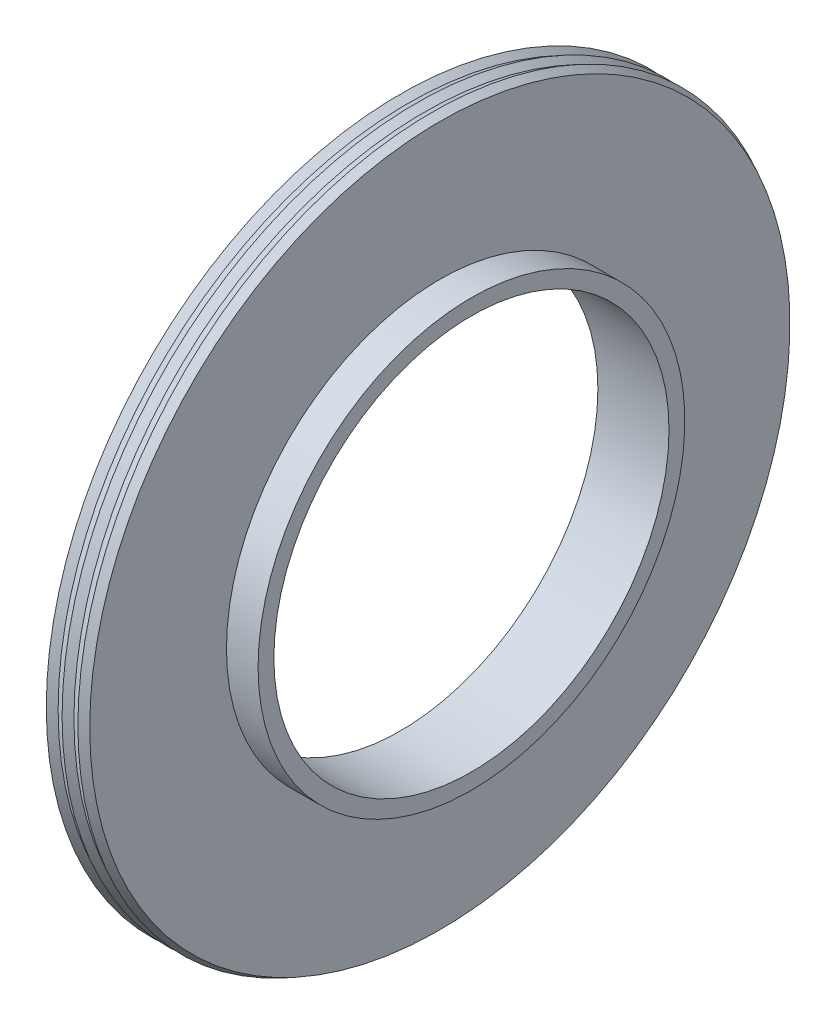
from build123d import *


with BuildPart() as part:
    # 草图1 → 旋转1 (revolve)
    with BuildSketch(Plane.XY, mode=Mode.PRIVATE) as revolve_1_sk:
        Polygon((0, 25), (9, 25), (9, 27), (5, 27), (5, 44.3), (4, 44.8), (3, 44.3), (2, 44.8), (1, 44.3), (0, 44.8), align=None)
    revolve(revolve_1_sk.sketch.rotate(Axis((-26.268864841, 0, 0), (1, 0, 0)), 90), axis=Axis((-26.268864841, 0, 0), (1, 0, 0)))


solid = part.part
